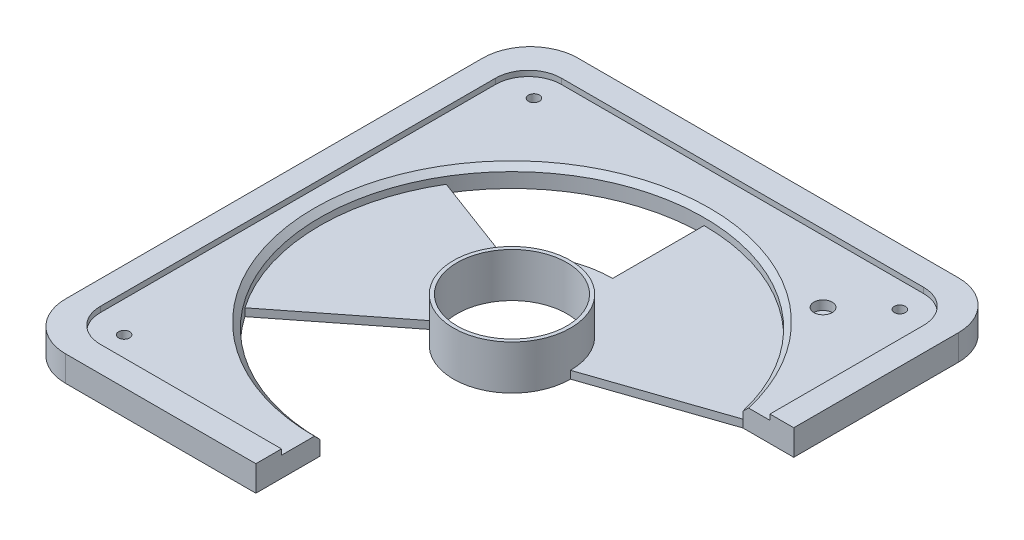
from build123d import *
from build123d.topology import SkipClean

# Parameters (mm, degrees)
SKETCH1_R           = 20.32
BOSS_EXTRUDE1_DEPTH = 15.367
SKETCH2_R           = 19.05
CUT_EXTRUDE1_DEPTH  = 33.587566479
BOSS_EXTRUDE2_DEPTH = 2.667
CUT_EXTRUDE2_DEPTH  = 96.144107805
SKETCH6_R           = 19.05
CUT_EXTRUDE3_DEPTH  = 96.144107805
SKETCH7_W           = 165.1
SKETCH7_H           = 177.8
SKETCH7_R           = 66.675
BOSS_EXTRUDE3_DEPTH = 6.985
SKETCH10_W          = 165.1
SKETCH10_H          = 177.8
SKETCH10_W_2        = 148.59
SKETCH10_H_2        = 160.02
BOSS_EXTRUDE5_DEPTH = 1.905
CUT_EXTRUDE4_DEPTH  = 122.605799303
CUT_EXTRUDE5_DEPTH  = 122.641870259
FILLET1_R           = 16.51
FILLET2_R           = 11.43
CHAMFER1_SIZE       = 1.905
SKETCH13_R          = 1.905
CUT_EXTRUDE6_DEPTH  = 122.605799303
SKETCH14_R          = 3.175
CUT_EXTRUDE7_DEPTH  = 3.175


with BuildPart() as part:
    # Sketch1 → Boss-Extrude1 (new body)
    with BuildSketch(Plane(origin=(0, 0, 0), x_dir=(1, 0, 0), z_dir=(0, 1, 0))):
        with Locations(Location((0, 0, 0), (0, 0, 270))):
            Circle(SKETCH1_R)
    extrude(amount=BOSS_EXTRUDE1_DEPTH)

    # Sketch2 → Cut-Extrude1 (cut, through all)
    with BuildSketch(Plane(origin=(0, 15.367, 0), x_dir=(1, 0, 0), z_dir=(0, 1, 0))):
        with Locations(Location((0, 0, 0), (0, 0, 270))):
            Circle(SKETCH2_R)
    extrude(amount=-CUT_EXTRUDE1_DEPTH, mode=Mode.SUBTRACT)

    # Sketch3 → Boss-Extrude2 (add)
    with BuildSketch(Plane(origin=(0, 0, 0), x_dir=(1, 0, 0), z_dir=(0, 1, 0))):
        with BuildLine():
            ThreePointArc((64.909922392, 15.24), (41.409109052, 52.25745222), (0, 66.675))
            Line((0, 66.675), (0, 34.925))
            ThreePointArc((0, 34.925), (-14.514994402, 31.765871033), (-26.404091066, 22.86))
            Line((-26.404091066, 22.86), (-57.15, 34.342875899))
            ThreePointArc((-57.15, 34.342875899), (-66.644798483, -2.006604135), (-54.980293415, -37.719))
            Line((-54.980293415, -37.719), (-29.91080298, -18.030515524))
            ThreePointArc((-29.91080298, -18.030515524), (11.688528505, -32.911000082), (34.583107671, 4.874862956))
            Line((34.583107671, 4.874862956), (64.909922392, 15.24))
        make_face()
    extrude(amount=BOSS_EXTRUDE2_DEPTH)

    # Sketch4 → Cut-Extrude2 (cut, through all)
    with SkipClean():  # the faces are left unmerged after this step: merging them gives an invalid solid
        with BuildSketch(Plane(origin=(0, 2.667, 0), x_dir=(1, 0, 0), z_dir=(0, 1, 0))):
            with BuildLine():
                Line((-29.91080298, -18.030515524), (-18.272118104, -8.89))
                ThreePointArc((-18.272118104, -8.89), (4.561412069, -19.801412069), (20.32, 0))
                Line((20.32, 0), (34.583107671, 4.874862956))
                ThreePointArc((34.583107671, 4.874862956), (15.066975095, -42.423579526), (-29.91080298, -18.030515524))
            make_face()
        extrude(amount=-CUT_EXTRUDE2_DEPTH, mode=Mode.SUBTRACT)

    # Sketch6 → Cut-Extrude3 (cut, through all)
    with SkipClean():  # the faces are left unmerged after this step: merging them gives an invalid solid
        with BuildSketch(Plane(origin=(0, 2.667, 0), x_dir=(1, 0, 0), z_dir=(0, 1, 0))):
            with Locations(Location((0, 0, 0), (0, 0, 270))):
                Circle(SKETCH6_R)
        extrude(amount=-CUT_EXTRUDE3_DEPTH, mode=Mode.SUBTRACT)

    # Sketch7 → Boss-Extrude3 (add)
    with SkipClean():  # the faces are left unmerged after this step: merging them gives an invalid solid
        with BuildSketch(Plane(origin=(0, 0, 0), x_dir=(1, 0, 0), z_dir=(0, 1, 0))):
            Rectangle(SKETCH7_W, SKETCH7_H)
            with Locations(Location((0, 0, 0), (0, 0, 90))):
                Circle(SKETCH7_R, mode=Mode.SUBTRACT)
        extrude(amount=BOSS_EXTRUDE3_DEPTH)

    # Sketch10 → Boss-Extrude5 (add)
    with SkipClean():  # the faces are left unmerged after this step: merging them gives an invalid solid
        with BuildSketch(Plane(origin=(0, 6.985, 0), x_dir=(1, 0, 0), z_dir=(0, 1, 0))):
            Rectangle(SKETCH10_W, SKETCH10_H)
            Rectangle(SKETCH10_W_2, SKETCH10_H_2, mode=Mode.SUBTRACT)
        extrude(amount=BOSS_EXTRUDE5_DEPTH)

    # Sketch11 → Cut-Extrude4 (cut, through all)
    with SkipClean():  # the faces are left unmerged after this step: merging them gives an invalid solid
        with BuildSketch(Plane(origin=(0, 6.985, 0), x_dir=(1, 0, 0), z_dir=(0, 1, 0))):
            with BuildLine():
                Line((64.909922392, 15.24), (82.55, 15.24))
                ThreePointArc((82.55, 15.24), (103.174054638, -85.896323799), (0, -88.9))
                Line((0, -88.9), (0, -66.675))
                ThreePointArc((0, -66.675), (26.234384866, -20.788279139), (64.909922392, 15.24))
            make_face()
        extrude(amount=-CUT_EXTRUDE4_DEPTH, mode=Mode.SUBTRACT)

    # Sketch12 → Cut-Extrude5 (cut, through all)
    with SkipClean():  # the faces are left unmerged after this step: merging them gives an invalid solid
        with BuildSketch(Plane(origin=(0, 8.89, 0), x_dir=(1, 0, 0), z_dir=(0, 1, 0))):
            with BuildLine():
                Line((74.295, 15.24), (82.55, 15.24))
                ThreePointArc((82.55, 15.24), (101.289385527, -84.402378772), (0, -88.9))
                Line((0, -88.9), (0, -80.01))
                ThreePointArc((0, -80.01), (30.780955415, -27.419095223), (74.295, 15.24))
            make_face()
        extrude(amount=-CUT_EXTRUDE5_DEPTH, mode=Mode.SUBTRACT)

    # Fillet1
    fillet1_edges = [part.edges().sort_by_distance(p)[0] for p in [
        (82.55, 3.4925, -88.9),
        (-82.55, 3.4925, -88.9),
        (-82.55, 3.4925, 88.9),
    ]]
    fillet(fillet1_edges, radius=FILLET1_R)

    # Fillet2
    fillet2_edges = [part.edges().sort_by_distance(p)[0] for p in [
        (74.295, 7.9375, -80.01),
        (-74.295, 7.9375, -80.01),
        (-74.295, 7.9375, 80.01),
    ]]
    fillet(fillet2_edges, radius=FILLET2_R)

    # Chamfer1
    chamfer1_edges = [part.edges().sort_by_distance(p)[0] for p in [
        (-66.675, 6.985, 0),
    ]]
    chamfer(chamfer1_edges, length=CHAMFER1_SIZE)

    # Sketch13 → Cut-Extrude6 (cut, through all)
    with SkipClean():  # the faces are left unmerged after this step: merging them gives an invalid solid
        with BuildSketch(Plane(origin=(0, 6.985, 0), x_dir=(1, 0, 0), z_dir=(0, 1, 0))):
            with Locations(Location((63.5, 71.12, 0), (0, 0, 270))):
                Circle(SKETCH13_R)
            with Locations(Location((-63.5, 71.12, 0), (0, 0, 270))):
                Circle(SKETCH13_R)
            with Locations(Location((-63.5, -71.12, 0), (0, 0, 270))):
                Circle(SKETCH13_R)
        extrude(amount=-CUT_EXTRUDE6_DEPTH, mode=Mode.SUBTRACT)

    # Sketch14 → Cut-Extrude7 (cut)
    with SkipClean():  # the faces are left unmerged after this step: merging them gives an invalid solid
        with BuildSketch(Plane(origin=(0, 6.985, 0), x_dir=(1, 0, 0), z_dir=(0, 1, 0))):
            with Locations(Location((49.53, 58.42, 0), (0, 0, 270))):
                Circle(SKETCH14_R)
        extrude(amount=-CUT_EXTRUDE7_DEPTH, mode=Mode.SUBTRACT)


solid = part.part
